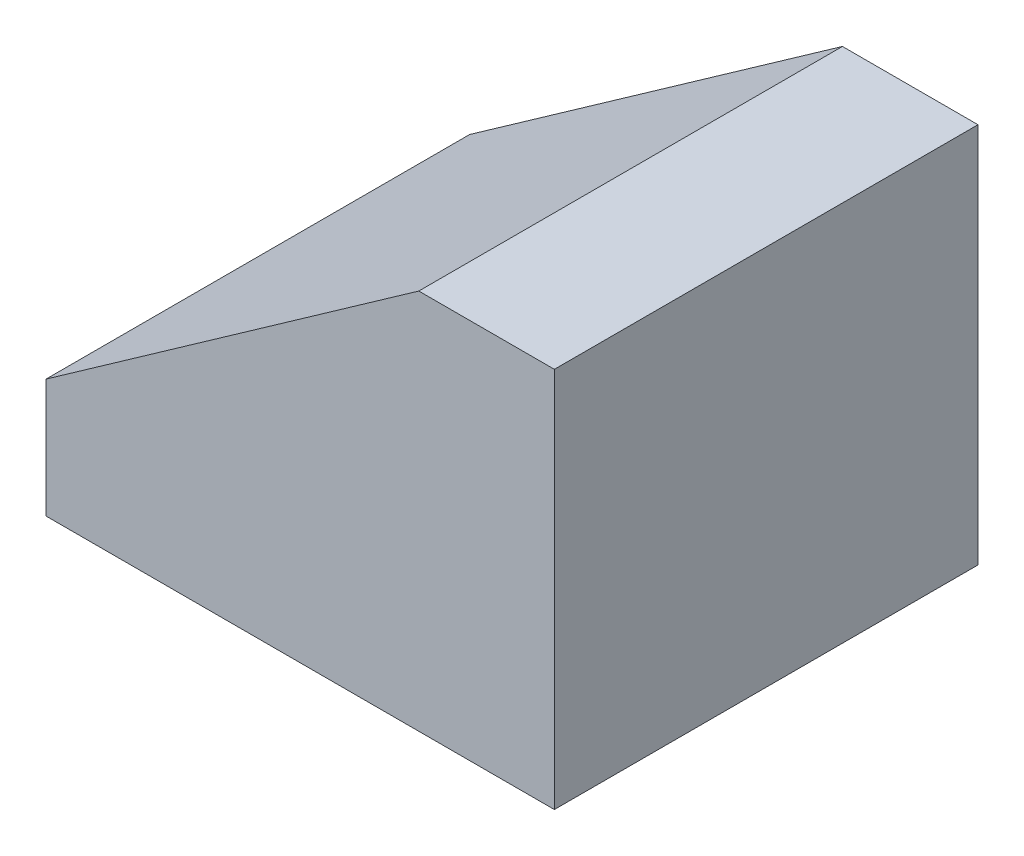
from build123d import *

# Parameters (mm, degrees)
BOSS_EXTRU_1_DEPTH = 100


with BuildPart() as part:
    # Esquisse1 → Boss.-Extru.1 (new body)
    with BuildSketch(Plane.XY):
        Polygon((0, 0), (-120, 0), (-120, 28), (-32, 90), (0, 90), align=None)
    extrude(amount=BOSS_EXTRU_1_DEPTH)


solid = part.part
